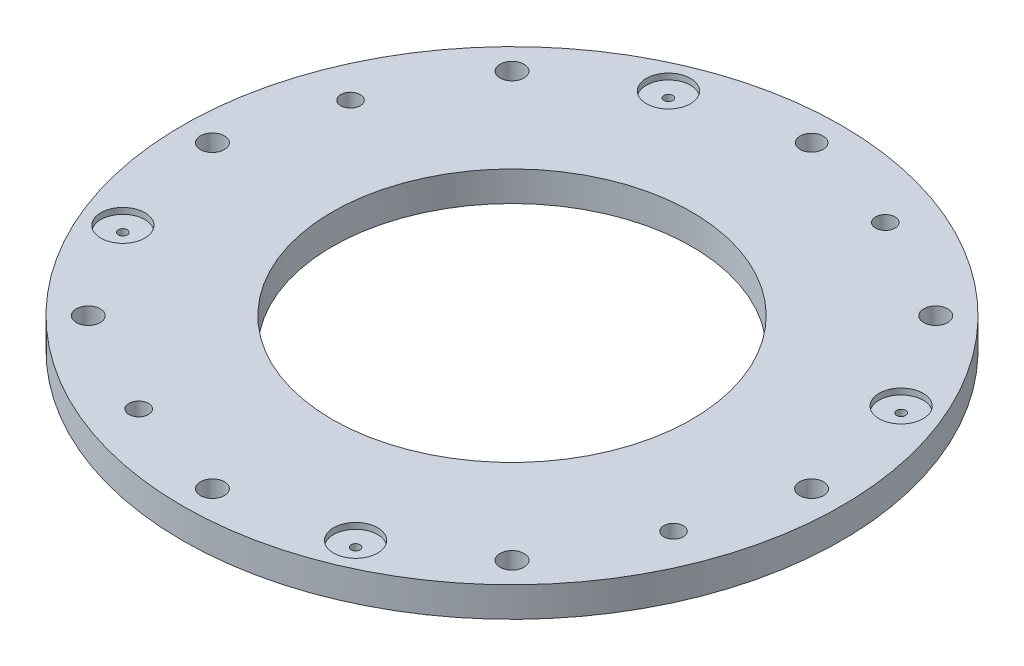
from build123d import *

# Parameters (mm, degrees)
CROQUIS1_R              = 110
SALIENTE_EXTRUIR1_DEPTH = 10
CROQUIS2_R              = 3.862102747
CROQUIS2_R_2            = 4
CORTAR_EXTRUIR1_DEPTH   = 10
CROQUIS3_R              = 60
CORTAR_EXTRUIR2_DEPTH   = 10
CROQUIS4_R              = 3.25
CORTAR_EXTRUIR3_DEPTH   = 10
CROQUIS5_R              = 7.35
CORTAR_EXTRUIR4_DEPTH   = 2
CROQUIS7_R              = 1.5
CORTAR_EXTRUIR5_DEPTH   = 10


with BuildPart() as part:
    # Croquis1 → Saliente-Extruir1 (new body)
    with BuildSketch(Plane(origin=(0, 0, 0), x_dir=(1, 0, 0), z_dir=(0, 1, 0))):
        with Locations(Location((0, 0, 0), (0, 0, 270))):
            Circle(CROQUIS1_R)
    extrude(amount=SALIENTE_EXTRUIR1_DEPTH)

    # Croquis2 → Cortar-Extruir1 (cut)
    with BuildSketch(Plane(origin=(0, 10, 0), x_dir=(1, 0, 0), z_dir=(0, 1, 0))):
        with Locations(Location((0, 100, 0), (0, 0, 270))):
            Circle(CROQUIS2_R)
        with Locations(Location((-100, 0, 0), (0, 0, 270))):
            Circle(CROQUIS2_R_2)
        with Locations(Location((0, -100, 0), (0, 0, 270))):
            Circle(CROQUIS2_R_2)
        with Locations(Location((100, 0, 0), (0, 0, 270))):
            Circle(CROQUIS2_R_2)
        with Locations(Location((-70.710678119, 70.710678119, 0), (0, 0, 270))):
            Circle(CROQUIS2_R_2)
        with Locations(Location((70.710678119, 70.710678119, 0), (0, 0, 270))):
            Circle(CROQUIS2_R_2)
        with Locations(Location((70.710678119, -70.710678119, 0), (0, 0, 270))):
            Circle(CROQUIS2_R_2)
        with Locations(Location((-70.710678119, -70.710678119, 0), (0, 0, 270))):
            Circle(CROQUIS2_R_2)
    extrude(amount=-CORTAR_EXTRUIR1_DEPTH, mode=Mode.SUBTRACT)

    # Croquis3 → Cortar-Extruir2 (cut)
    with BuildSketch(Plane(origin=(0, 10, 0), x_dir=(1, 0, 0), z_dir=(0, 1, 0))):
        with Locations(Location((0, 0, 0), (0, 0, 270))):
            Circle(CROQUIS3_R)
    extrude(amount=-CORTAR_EXTRUIR2_DEPTH, mode=Mode.SUBTRACT)

    # Croquis4 → Cortar-Extruir3 (cut)
    with BuildSketch(Plane(origin=(0, 10, 0), x_dir=(1, 0, 0), z_dir=(0, 1, 0))):
        with Locations(Location((89.254735783, -35.349570581, 0), (0, 0, 270))):
            Circle(CROQUIS4_R)
        with Locations(Location((-35.349570581, -89.254735783, 0), (0, 0, 270))):
            Circle(CROQUIS4_R)
        with Locations(Location((-89.254735783, 35.349570581, 0), (0, 0, 270))):
            Circle(CROQUIS4_R)
        with Locations(Location((35.349570581, 89.254735783, 0), (0, 0, 270))):
            Circle(CROQUIS4_R)
    extrude(amount=-CORTAR_EXTRUIR3_DEPTH, mode=Mode.SUBTRACT)

    # Croquis5 → Cortar-Extruir4 (cut)
    with BuildSketch(Plane(origin=(0, 10, 0), x_dir=(1, 0, 0), z_dir=(0, 1, 0))):
        with Locations(Location((91.046524442, 38.842229875, 0), (0, 0, 270))):
            Circle(CROQUIS5_R)
        with Locations(Location((38.842229875, -91.046524442, 0), (0, 0, 270))):
            Circle(CROQUIS5_R)
        with Locations(Location((-91.046524442, -38.842229875, 0), (0, 0, 270))):
            Circle(CROQUIS5_R)
        with Locations(Location((-38.842229875, 91.046524442, 0), (0, 0, 270))):
            Circle(CROQUIS5_R)
    extrude(amount=-CORTAR_EXTRUIR4_DEPTH, mode=Mode.SUBTRACT)

    # Croquis7 → Cortar-Extruir5 (cut)
    with BuildSketch(Plane(origin=(0, 10, 0), x_dir=(1, 0, 0), z_dir=(0, 1, 0))):
        with Locations(Location((-38.842229875, 91.046524442, 0), (0, 0, 270))):
            Circle(CROQUIS7_R)
        with Locations(Location((91.046524442, 38.842229875, 0), (0, 0, 270))):
            Circle(CROQUIS7_R)
        with Locations(Location((38.842229875, -91.046524442, 0), (0, 0, 270))):
            Circle(CROQUIS7_R)
        with Locations(Location((-91.046524442, -38.842229875, 0), (0, 0, 270))):
            Circle(CROQUIS7_R)
    extrude(amount=-CORTAR_EXTRUIR5_DEPTH, mode=Mode.SUBTRACT)


solid = part.part
